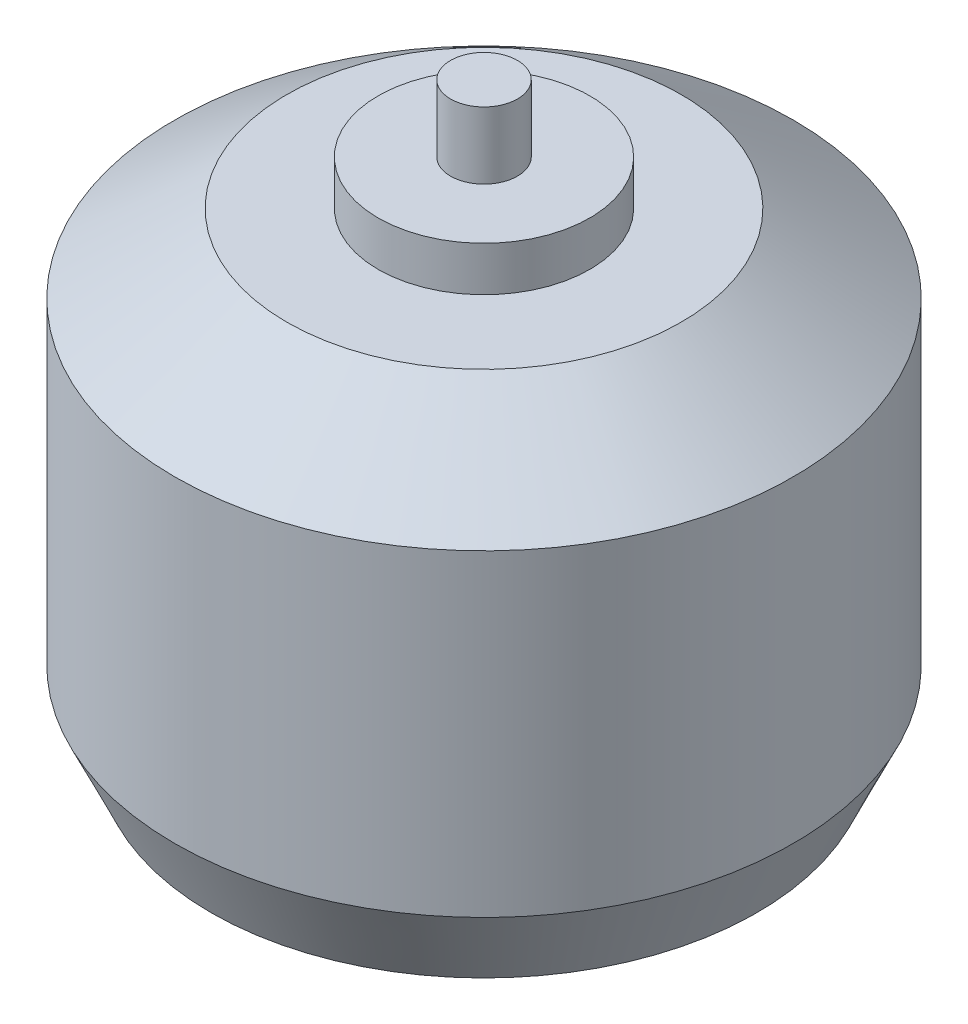
from build123d import *


with BuildPart() as part:
    # Sketch1 → Revolve1 (revolve)
    with BuildSketch(Plane(origin=(0, 0, 0), x_dir=(0, 0, -1), z_dir=(1, 0, 0))):
        Polygon((0, 0), (-12.25, 0), (-13.875, 3.5), (-13.875, 17.75), (-8.85, 21.25), (-4.75, 21.25), (-4.75, 23.25), (-1.5, 23.25), (-1.5, 26.25), (0, 26.25), align=None)
    revolve(axis=Axis((0, 26.25, 0), (0, -1, 0)))


solid = part.part
